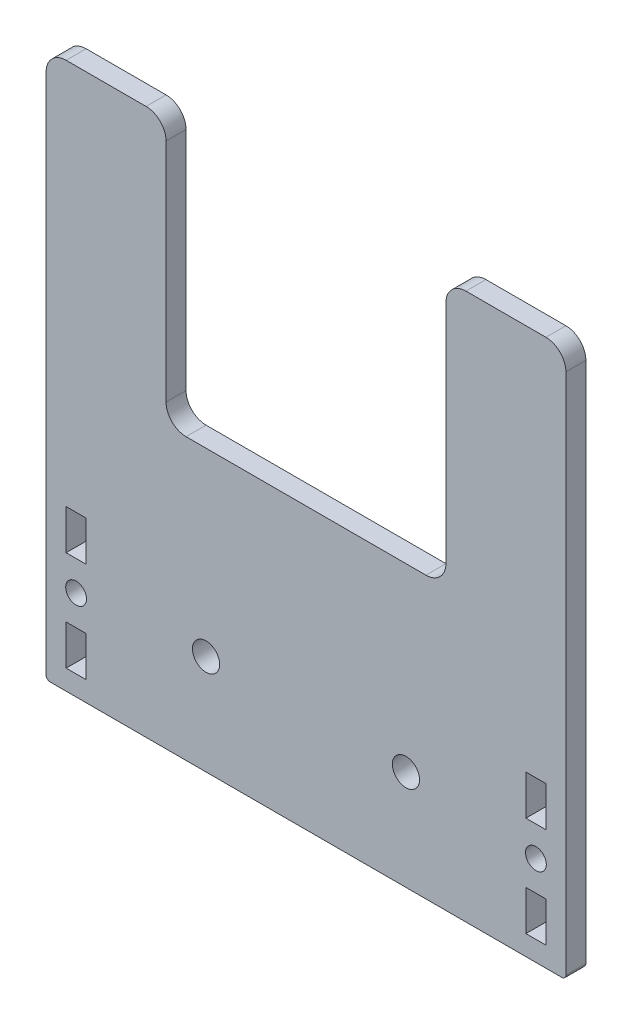
from build123d import *

# Parameters (mm, degrees)
SKETCH1_W           = 130
SKETCH1_H           = 136.666666666
SKETCH1_R           = 3.4
BOSS_EXTRUDE1_DEPTH = 5
SKETCH2_R           = 2.6
SKETCH2_W           = 70
SKETCH2_H           = 110.094716781
SKETCH2_W_2         = 5
SKETCH2_H_2         = 10
CUT_EXTRUDE1_DEPTH  = 5
FILLET1_R           = 5
FILLET2_R           = 1


with BuildPart() as part:
    # Sketch1 → Boss-Extrude1 (new body)
    with BuildSketch(Plane.XY):
        Rectangle(SKETCH1_W, SKETCH1_H)
        with Locations((-25, -43.333333333)):
            Circle(SKETCH1_R, mode=Mode.SUBTRACT)
        with Locations(Location((25, -43.333333333, 0), (0, 0, 180))):
            Circle(SKETCH1_R, mode=Mode.SUBTRACT)
    extrude(amount=BOSS_EXTRUDE1_DEPTH)

    # Sketch2 → Cut-Extrude1 (cut)
    with BuildSketch(Plane.XY.offset(5)):
        with Locations((-57.5, -45.833333333)):
            Circle(SKETCH2_R)
        with Locations(Location((57.5, -45.833333333, 0), (0, 0, 180))):
            Circle(SKETCH2_R)
        with Locations((0, 56.850465305)):
            Rectangle(SKETCH2_W, SKETCH2_H)
        with Locations((-57.5, -33.333333333)):
            Rectangle(SKETCH2_W_2, SKETCH2_H_2)
        with Locations((-57.5, -58.333333333)):
            Rectangle(SKETCH2_W_2, SKETCH2_H_2)
        with Locations((57.5, -33.333333333)):
            Rectangle(SKETCH2_W_2, SKETCH2_H_2)
        with Locations((57.5, -58.333333333)):
            Rectangle(SKETCH2_W_2, SKETCH2_H_2)
    extrude(amount=-CUT_EXTRUDE1_DEPTH, mode=Mode.SUBTRACT)

    # Fillet1
    fillet1_edges = [part.edges().sort_by_distance(p)[0] for p in [
        (35, 68.333333333, 2.5),
        (-35, 68.333333333, 2.5),
        (-35, 1.803106914, 2.5),
        (35, 1.803106914, 2.5),
        (-65, 68.333333333, 2.5),
        (65, 68.333333333, 2.5),
    ]]
    fillet(fillet1_edges, radius=FILLET1_R)

    # Fillet2
    fillet2_edges = [part.edges().sort_by_distance(p)[0] for p in [
        (65, -68.333333333, 2.5),
        (-65, -68.333333333, 2.5),
    ]]
    fillet(fillet2_edges, radius=FILLET2_R)


solid = part.part
